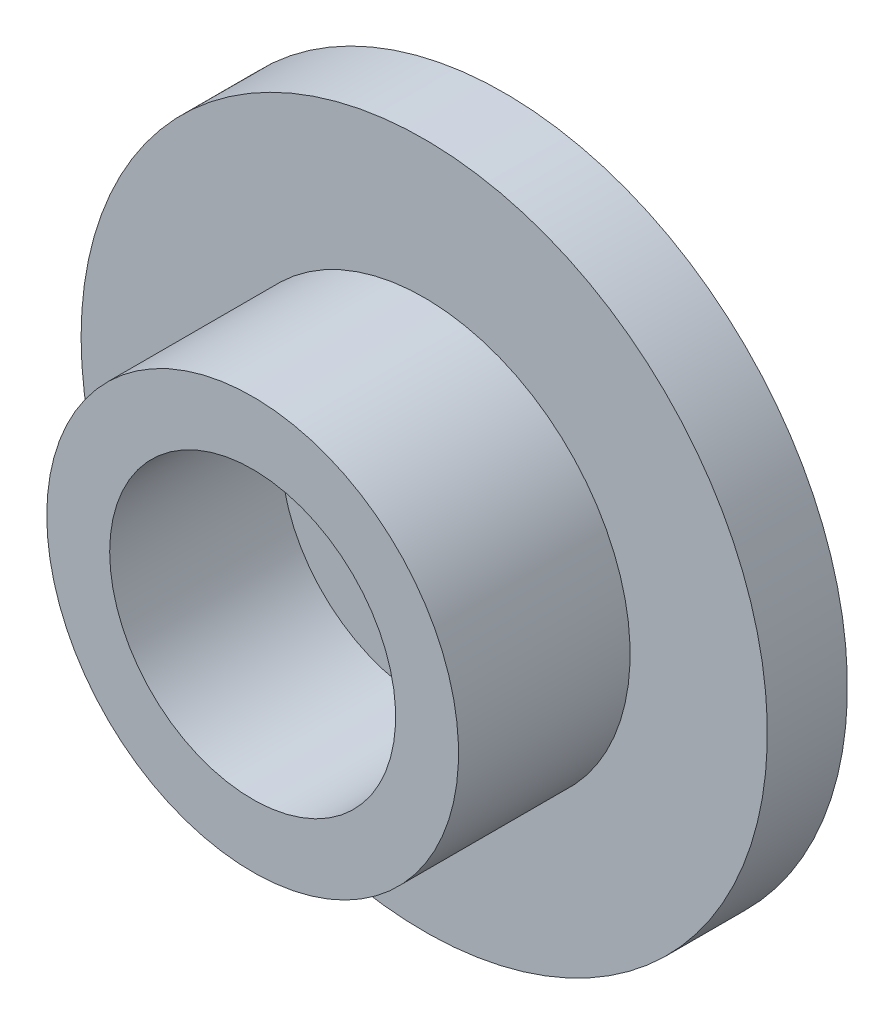
from build123d import *

# Parameters (mm, degrees)
SKETCH_1_R      = 18
SKETCH_1_R_2    = 12.5
EXTRUDE_1_DEPTH = 7
SKETCH_3_R      = 18
SKETCH_3_R_2    = 12.5
EXTRUDE_2_DEPTH = 22
EXTRUDE_START   = -14
SKETCH_4_R      = 30
EXTRUDE_3_DEPTH = 7


with BuildPart() as part:
    # Эскиз1 → Вытянуть1 (new body)
    with BuildSketch(Plane.XY):
        Circle(SKETCH_1_R)
        Circle(SKETCH_1_R_2, mode=Mode.SUBTRACT)
    extrude(amount=EXTRUDE_1_DEPTH)

    # Эскиз3 → Вытянуть2 (add)
    with BuildSketch(Plane.XY.offset(7)):
        with Locations(Location((0, 0, 0), (0, 0, 180))):
            Circle(SKETCH_3_R)
        with Locations(Location((0, 0, 0), (0, 0, 180))):
            Circle(SKETCH_3_R_2, mode=Mode.SUBTRACT)
    extrude(amount=EXTRUDE_2_DEPTH)

    # Эскиз4 → Вытянуть3 (add)
    with BuildSketch(Plane(origin=(0, 0, 0), x_dir=(-1, 0, 0), z_dir=(0, 0, -1)).offset(EXTRUDE_START)):
        Circle(SKETCH_4_R)
    extrude(amount=EXTRUDE_3_DEPTH)


solid = part.part
